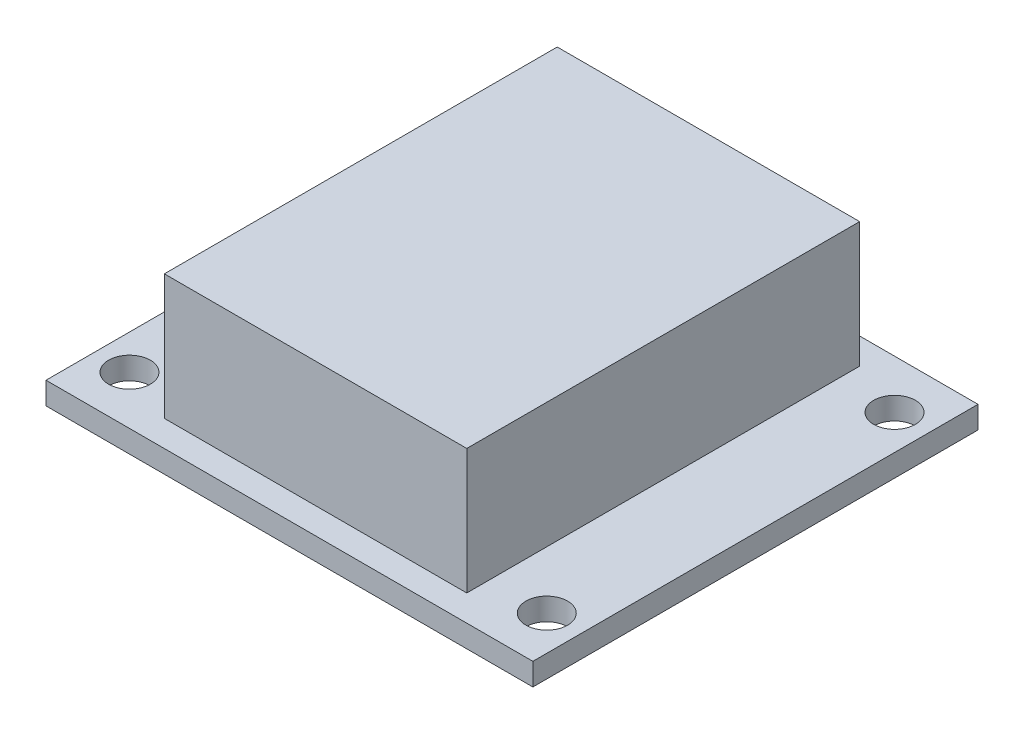
from build123d import *

# Parameters (mm, degrees)
SKETCH1_W           = 35
SKETCH1_H           = 32
SKETCH1_R           = 1.5
BOSS_EXTRUDE1_DEPTH = 1.6
SKETCH2_W           = 21.740757606
SKETCH2_H           = 28.24370202
BOSS_EXTRUDE2_DEPTH = 9


with BuildPart() as part:
    # Sketch1 → Boss-Extrude1 (new body)
    with BuildSketch(Plane(origin=(0, 0, 0), x_dir=(1, 0, 0), z_dir=(0, 1, 0))):
        Rectangle(SKETCH1_W, SKETCH1_H)
        with Locations(Location((-15, 12.5, 0), (0, 0, 270))):
            Circle(SKETCH1_R, mode=Mode.SUBTRACT)
        with Locations(Location((15, 12.5, 0), (0, 0, 90))):
            Circle(SKETCH1_R, mode=Mode.SUBTRACT)
        with Locations(Location((15, -12.5, 0), (0, 0, 270))):
            Circle(SKETCH1_R, mode=Mode.SUBTRACT)
        with Locations(Location((-15, -12.5, 0), (0, 0, 90))):
            Circle(SKETCH1_R, mode=Mode.SUBTRACT)
    extrude(amount=BOSS_EXTRUDE1_DEPTH)

    # Sketch2 → Boss-Extrude2 (add)
    with BuildSketch(Plane(origin=(0, 1.6, 0), x_dir=(1, 0, 0), z_dir=(0, 1, 0))):
        Rectangle(SKETCH2_W, SKETCH2_H)
    extrude(amount=BOSS_EXTRUDE2_DEPTH)


solid = part.part
